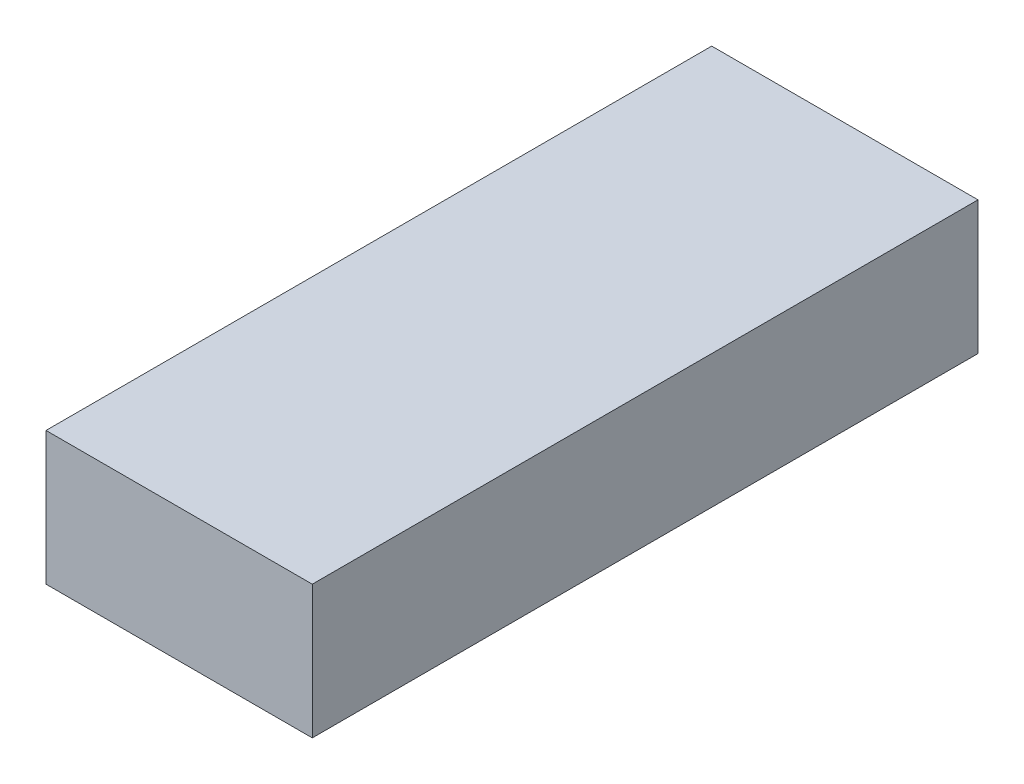
from build123d import *

# Parameters (mm, degrees)
SKETCH1_W           = 304.8
SKETCH1_H           = 304.8
BOSS_EXTRUDE1_DEPTH = 6.35
CUT_EXTRUDE2_DEPTH  = 6.35


with BuildPart() as part:
    # Sketch1 → Boss-Extrude1 (new body)
    with BuildSketch(Plane(origin=(0, 0, 0), x_dir=(1, 0, 0), z_dir=(0, 1, 0))):
        with Locations((152.4, 152.4)):
            Rectangle(SKETCH1_W, SKETCH1_H)
    extrude(amount=BOSS_EXTRUDE1_DEPTH)

    # Sketch2 → Cut-Extrude2 (cut)
    with BuildSketch(Plane(origin=(0, 6.35, 0), x_dir=(1, 0, 0), z_dir=(0, 1, 0))):
        Polygon((12.7, 304.8), (12.7, 273.05), (0, 273.05), (0, 0), (304.8, 0), (304.8, 304.8), align=None)
    extrude(amount=-CUT_EXTRUDE2_DEPTH, mode=Mode.SUBTRACT)


solid = part.part
